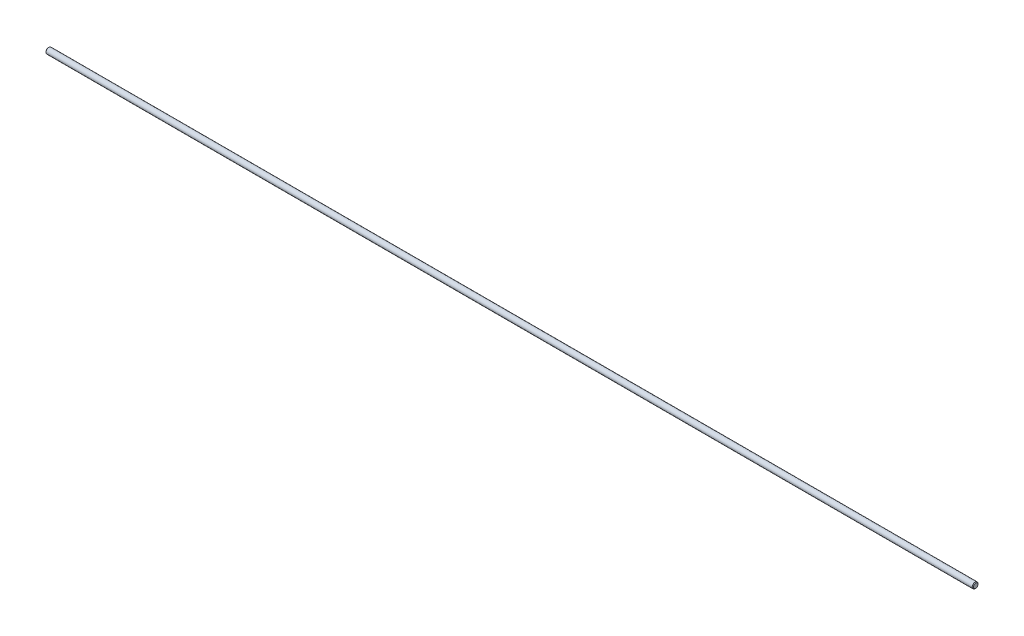
from build123d import *

# Parameters (mm, degrees)
EXTRUDE1_DEPTH      = 762
EXTRUDE1_DEPTH_BACK = 762
SKETCH2_R           = 4.7625
CHAMFER1_SIZE       = 0.9525


with BuildPart() as part:
    # Sketch2 → Extrude1 (new, two sides: drawn at the far end of the back side and taken through both)
    with BuildSketch(Plane(origin=(0, 0, 0), x_dir=(0, 0, -1), z_dir=(1, 0, 0)).offset(-EXTRUDE1_DEPTH_BACK)):
        Circle(SKETCH2_R)
    extrude(amount=EXTRUDE1_DEPTH + EXTRUDE1_DEPTH_BACK)

    # Chamfer1
    chamfer1_edges = [part.edges().sort_by_distance(p)[0] for p in [
        (-762, 0, 4.7625),
        (762, 0, 4.7625),
    ]]
    chamfer(chamfer1_edges, length=CHAMFER1_SIZE)


solid = part.part
